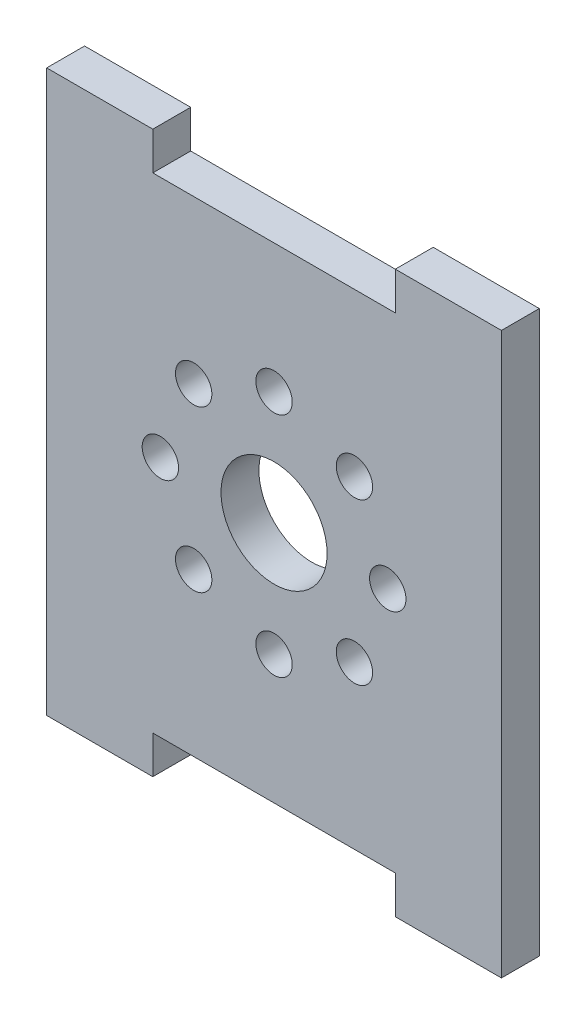
from build123d import *

# Parameters (mm, degrees)
ESQUISSE1_R                  = 3.5
BOSS_EXTRU_1_DEPTH           = 2.5
R_P_TITION_CIRCULAIRE1_COUNT = 8


with BuildPart() as part:
    # Esquisse1 → Boss.-Extru.1 (new body)
    with BuildSketch(Plane.XY):
        Polygon((8, -18.5), (15, -18.5), (15, 18.5), (8, 18.5), (8, 16), (-8, 16), (-8, 18.5), (-15, 18.5), (-15, -18.5), (-8, -18.5), (-8, -16), (8, -16), align=None)
        Circle(ESQUISSE1_R, mode=Mode.SUBTRACT)
    extrude(amount=BOSS_EXTRU_1_DEPTH)

    # Esquisse3 → Dégagement M21 (revolve, cut)
    with BuildSketch(Plane(origin=(0, 7.5, 2.5), x_dir=(0, -1, 0), z_dir=(1, 0, 0))):
        Polygon((0, 0), (0, 3.221032743), (1.2, 2.5), (1.2, 0), align=None)
    d_gagement_m21 = revolve(axis=Axis((0, 7.5, 8.85), (0, 0, -1)), mode=Mode.SUBTRACT)

    # Répétition circulaire1: Dégagement M21 ×8 about axis
    r_p_tition_circulaire1_axis = Axis((0, 0, 0), (0, 0, 1))
    for i in range(1, R_P_TITION_CIRCULAIRE1_COUNT):
        add(d_gagement_m21.rotate(r_p_tition_circulaire1_axis, i * 360 / R_P_TITION_CIRCULAIRE1_COUNT), mode=Mode.SUBTRACT)


solid = part.part
